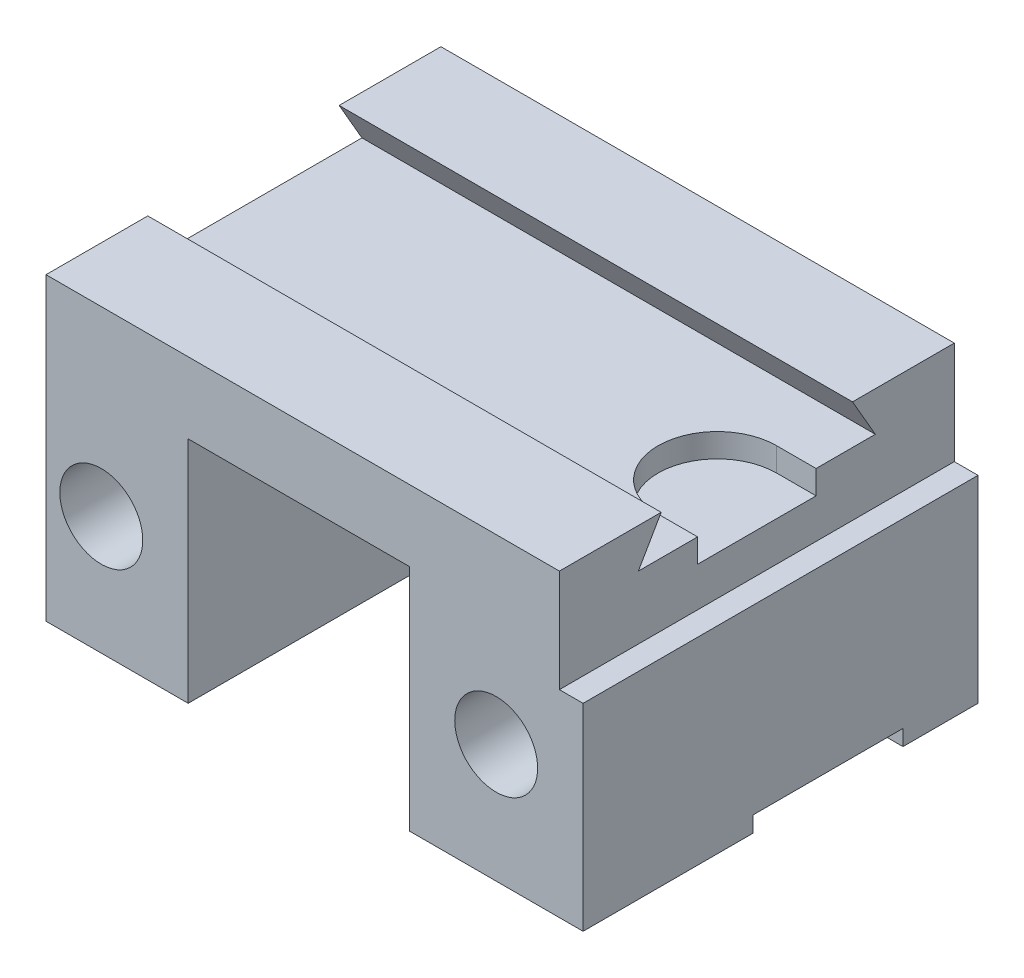
from build123d import *

# Parameters (mm, degrees)
SKETCH1_W           = 6.8
SKETCH1_H           = 5
BOSS_EXTRUDE1_DEPTH = 3.8
SKETCH3_W           = 2.8
SKETCH3_H           = 2.9
CUT_EXTRUDE2_DEPTH  = 10.340235543
SKETCH4_W           = 1.9
SKETCH4_H           = 0.2
CUT_EXTRUDE3_DEPTH  = 2.2
HOLE1_D             = 1.05
HOLE1_CBORE_D       = 1.3
HOLE1_CBORE_DEPTH   = 1.2
CUT_EXTRUDE9_DEPTH  = 10.340235543
CUT_EXTRUDE10_DEPTH = 0.3
SKETCH20_W          = 5
SKETCH20_H          = 1.3
CUT_EXTRUDE11_DEPTH = 0.3


with BuildPart() as part:
    # Sketch1 → Boss-Extrude1 (new body)
    with BuildSketch(Plane(origin=(0, 4, 0), x_dir=(-1, 0, 0), z_dir=(0, 1, 0))):
        with Locations((-3.4, 2.5)):
            Rectangle(SKETCH1_W, SKETCH1_H)
    extrude(amount=-BOSS_EXTRUDE1_DEPTH)

    # Sketch3 → Cut-Extrude2 (cut, through all)
    with BuildSketch(Plane.XY.offset(5)):
        with Locations((3.2, 1.65)):
            Rectangle(SKETCH3_W, SKETCH3_H)
    extrude(amount=-CUT_EXTRUDE2_DEPTH, mode=Mode.SUBTRACT)

    # Sketch4 → Cut-Extrude3 (cut)
    with BuildSketch(Plane(origin=(6.8, 0, 0), x_dir=(0, 0, -1), z_dir=(1, 0, 0))):
        with Locations((-1.9, 0.3)):
            Rectangle(SKETCH4_W, SKETCH4_H)
    extrude(amount=-CUT_EXTRUDE3_DEPTH, mode=Mode.SUBTRACT)

    # Hole1 (through all)
    with Locations(Plane(origin=(0, 0, 0), x_dir=(-1, 0, 0), z_dir=(0, 0, -1))):
        with Locations((-5.7, 1.7), (-0.7, 1.7)):
            CounterBoreHole(HOLE1_D / 2, HOLE1_CBORE_D / 2, HOLE1_CBORE_DEPTH)

    # Sketch18 → Cut-Extrude9 (cut, through all)
    with BuildSketch(Plane(origin=(6.8, 0, 0), x_dir=(0, 0, -1), z_dir=(1, 0, 0))):
        Polygon((-1.288675135, 4), (-3.711324865, 4), (-4, 3.5), (-1, 3.5), align=None)
    extrude(amount=-CUT_EXTRUDE9_DEPTH, mode=Mode.SUBTRACT)

    # Sketch19 → Cut-Extrude10 (cut)
    with BuildSketch(Plane(origin=(0, 3.5, 0), x_dir=(1, 0, 0), z_dir=(0, 1, 0))):
        with BuildLine():
            Line((6.8, -1.75), (6, -1.75))
            ThreePointArc((6, -1.75), (6.530330086, -1.969669914), (6.75, -2.5))
            ThreePointArc((6.75, -2.5), (6.530330086, -3.030330086), (6, -3.25))
            Line((6, -3.25), (6.8, -3.25))
            Line((6.8, -3.25), (6.8, -1.75))
        make_face()
        with BuildLine():
            ThreePointArc((6.75, -2.5), (6.530330086, -1.969669914), (6, -1.75))
            Line((6, -1.75), (6, -3.25))
            ThreePointArc((6, -3.25), (6.530330086, -3.030330086), (6.75, -2.5))
        make_face()
        with BuildLine():
            Line((6, -3.25), (6, -1.75))
            ThreePointArc((6, -1.75), (5.25, -2.5), (6, -3.25))
        make_face()
    extrude(amount=-CUT_EXTRUDE10_DEPTH, mode=Mode.SUBTRACT)

    # Sketch20 → Cut-Extrude11 (cut)
    with BuildSketch(Plane(origin=(6.8, 0, 0), x_dir=(0, 0, -1), z_dir=(1, 0, 0))):
        with Locations((-2.5, 3.35)):
            Rectangle(SKETCH20_W, SKETCH20_H)
    extrude(amount=-CUT_EXTRUDE11_DEPTH, mode=Mode.SUBTRACT)


solid = part.part
